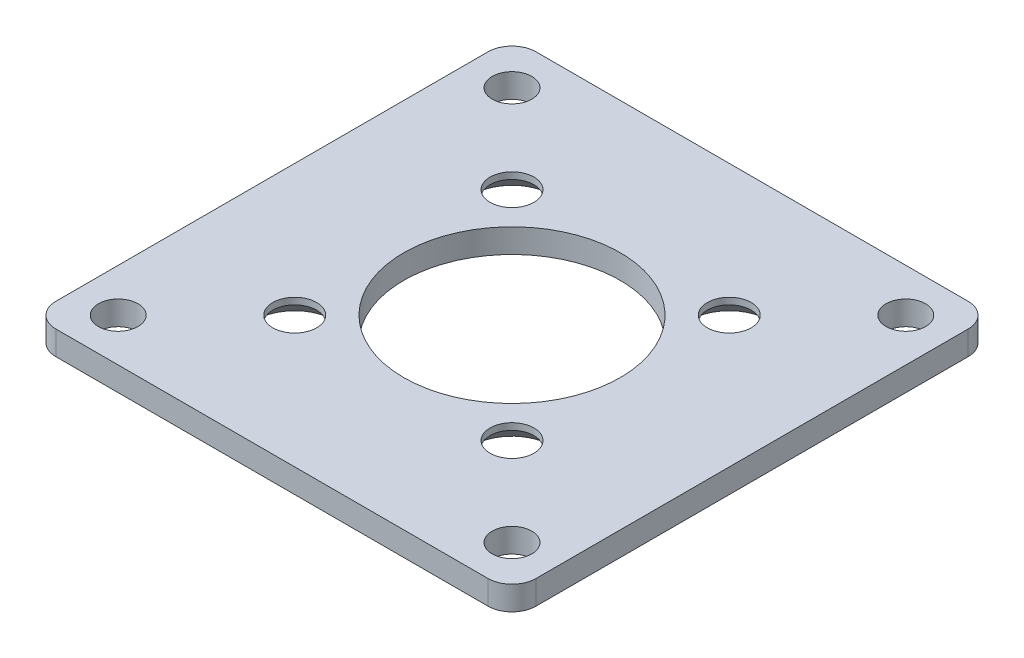
from build123d import *

# Parameters (mm, degrees)
SKETCH1_W                                       = 63.5
SKETCH1_H                                       = 63.5
BOSS_EXTRUDE1_DEPTH                             = 3.175
CUT_EXTRUDE1_REACH                              = 47.013
SKETCH2_R                                       = 14.3129
CSK_FOR_M5_FLAT_HEAD_MACHINE_SCREW1_D           = 5.8
CSK_FOR_M5_FLAT_HEAD_MACHINE_SCREW1_DEPTH       = 6.35
CSK_FOR_M5_FLAT_HEAD_MACHINE_SCREW1_CSINK_D     = 10.4
CSK_FOR_M5_FLAT_HEAD_MACHINE_SCREW1_CSINK_ANGLE = 90
CSK_FOR_M5_FLAT_HEAD_MACHINE_SCREW1_TIP         = 1.742495795
FILLET1_R                                       = 3.175
CUT_EXTRUDE2_REACH                              = 47.013
SKETCH5_R                                       = 2.6162


with BuildPart() as part:
    # Sketch1 → Boss-Extrude1 (new body)
    with BuildSketch(Plane(origin=(0, 0, 0), x_dir=(1, 0, 0), z_dir=(0, 1, 0))):
        Rectangle(SKETCH1_W, SKETCH1_H)
    extrude(amount=BOSS_EXTRUDE1_DEPTH)

    # Sketch2 → Cut-Extrude1 (cut, up to next)
    with BuildSketch(Plane(origin=(0, 3.175, 0), x_dir=(1, 0, 0), z_dir=(0, 1, 0)), mode=Mode.PRIVATE) as cut_extrude1_sk1:
        with Locations(Location((0, 0, 0), (0, 0, 270))):
            Circle(SKETCH2_R)
    cut_extrude1_tool1 = extrude(cut_extrude1_sk1.sketch, amount=-CUT_EXTRUDE1_REACH, mode=Mode.PRIVATE) & part.part
    add(cut_extrude1_tool1.solids().sort_by_distance((0, 3.175, 0))[0], mode=Mode.SUBTRACT)

    # CSK for M5 Flat Head Machine Screw1
    with Locations(Plane(origin=(-14.368409794, 0, 14.368409794), x_dir=(0, 0, -1), z_dir=(0, -1, 0))):
        with Locations((0, 0), (0, 28.736819588), (28.736819588, 28.736819588), (28.736819588, 0)):
            CounterSinkHole(CSK_FOR_M5_FLAT_HEAD_MACHINE_SCREW1_D / 2, CSK_FOR_M5_FLAT_HEAD_MACHINE_SCREW1_CSINK_D / 2, depth=CSK_FOR_M5_FLAT_HEAD_MACHINE_SCREW1_DEPTH, counter_sink_angle=CSK_FOR_M5_FLAT_HEAD_MACHINE_SCREW1_CSINK_ANGLE)
            with Locations((0, 0, -(CSK_FOR_M5_FLAT_HEAD_MACHINE_SCREW1_DEPTH + CSK_FOR_M5_FLAT_HEAD_MACHINE_SCREW1_TIP / 2))):  # 118° drill point
                Cone(0, CSK_FOR_M5_FLAT_HEAD_MACHINE_SCREW1_D / 2, CSK_FOR_M5_FLAT_HEAD_MACHINE_SCREW1_TIP, mode=Mode.SUBTRACT)

    # Fillet1
    fillet1_edges = [part.edges().sort_by_distance(p)[0] for p in [
        (-31.75, 1.5875, -31.75),
        (31.75, 1.5875, -31.75),
        (31.75, 1.5875, 31.75),
        (-31.75, 1.5875, 31.75),
    ]]
    fillet(fillet1_edges, radius=FILLET1_R)

    # Sketch5 → Cut-Extrude2 (cut, up to next)
    with BuildSketch(Plane(origin=(0, 0, 0), x_dir=(-1, 0, 0), z_dir=(0, -1, 0)), mode=Mode.PRIVATE) as cut_extrude2_sk1:
        with Locations(Location((-26.042742751, -26.042742751, 0), (0, 0, 90))):
            Circle(SKETCH5_R)
    cut_extrude2_tool1 = extrude(cut_extrude2_sk1.sketch, amount=-CUT_EXTRUDE2_REACH, mode=Mode.PRIVATE) & part.part
    # Sketch5 → Cut-Extrude2 (cut, up to next)
    with BuildSketch(Plane(origin=(0, 0, 0), x_dir=(-1, 0, 0), z_dir=(0, -1, 0)), mode=Mode.PRIVATE) as cut_extrude2_sk2:
        with Locations(Location((-26.042742751, 26.042742751, 0), (0, 0, 90))):
            Circle(SKETCH5_R)
    cut_extrude2_tool2 = extrude(cut_extrude2_sk2.sketch, amount=-CUT_EXTRUDE2_REACH, mode=Mode.PRIVATE) & part.part
    # Sketch5 → Cut-Extrude2 (cut, up to next)
    with BuildSketch(Plane(origin=(0, 0, 0), x_dir=(-1, 0, 0), z_dir=(0, -1, 0)), mode=Mode.PRIVATE) as cut_extrude2_sk3:
        with Locations(Location((26.042742751, 26.042742751, 0), (0, 0, 90))):
            Circle(SKETCH5_R)
    cut_extrude2_tool3 = extrude(cut_extrude2_sk3.sketch, amount=-CUT_EXTRUDE2_REACH, mode=Mode.PRIVATE) & part.part
    # Sketch5 → Cut-Extrude2 (cut, up to next)
    with BuildSketch(Plane(origin=(0, 0, 0), x_dir=(-1, 0, 0), z_dir=(0, -1, 0)), mode=Mode.PRIVATE) as cut_extrude2_sk4:
        with Locations(Location((26.042742751, -26.042742751, 0), (0, 0, 90))):
            Circle(SKETCH5_R)
    cut_extrude2_tool4 = extrude(cut_extrude2_sk4.sketch, amount=-CUT_EXTRUDE2_REACH, mode=Mode.PRIVATE) & part.part
    add(cut_extrude2_tool1.solids().sort_by_distance((26.042743, 0, 26.042743))[0], mode=Mode.SUBTRACT)
    add(cut_extrude2_tool2.solids().sort_by_distance((26.042743, 0, -26.042743))[0], mode=Mode.SUBTRACT)
    add(cut_extrude2_tool3.solids().sort_by_distance((-26.042743, 0, -26.042743))[0], mode=Mode.SUBTRACT)
    add(cut_extrude2_tool4.solids().sort_by_distance((-26.042743, 0, 26.042743))[0], mode=Mode.SUBTRACT)


solid = part.part
